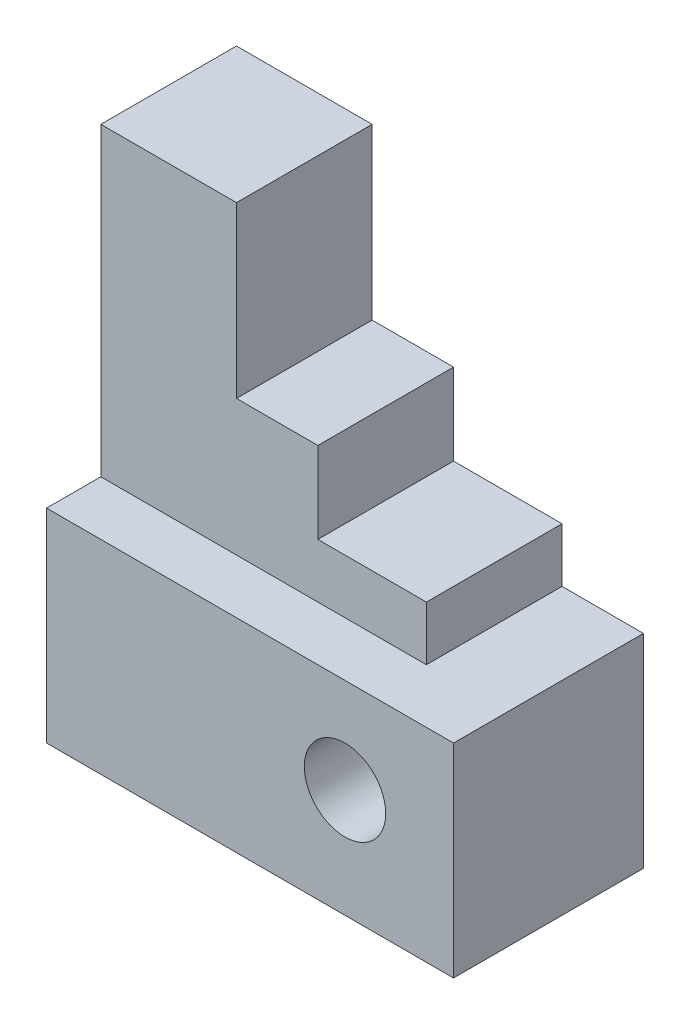
from build123d import *

# Parameters (mm, degrees)
SKETCH1_W               = 60
SKETCH1_H               = 28
BOSS_EXTRUDE1_DEPTH     = 75
CUT_EXTRUDE1_DEPTH      = 45
CUT_EXTRUDE2_DEPTH      = 99.107084352
CUT_EXTRUDE2_DEPTH_BACK = 99.107084352
SKETCH3_R               = 6


with BuildPart() as part:
    # Sketch1 → Boss-Extrude1 (new body)
    with BuildSketch(Plane(origin=(0, 0, 0), x_dir=(1, 0, 0), z_dir=(0, 1, 0))):
        with Locations((30, 14)):
            Rectangle(SKETCH1_W, SKETCH1_H)
    extrude(amount=BOSS_EXTRUDE1_DEPTH)

    # Sketch2 → Cut-Extrude1 (cut)
    with BuildSketch(Plane(origin=(0, 75, 0), x_dir=(1, 0, 0), z_dir=(0, 1, 0))):
        Polygon((60, 28), (48, 28), (48, 8), (0, 8), (0, 0), (48, 0), (60, 0), align=None)
    extrude(amount=-CUT_EXTRUDE1_DEPTH, mode=Mode.SUBTRACT)

    # Sketch3 → Cut-Extrude2 (cut, two sides: drawn at the far end of the back side and taken through both)
    with BuildSketch(Plane.XY.offset(-8).offset(-CUT_EXTRUDE2_DEPTH_BACK)):
        Polygon((32, 50), (32, 38), (48, 38), (48, 75), (20, 75), (20, 50), align=None)
        with Locations((44, 16)):
            Circle(SKETCH3_R)
    extrude(amount=CUT_EXTRUDE2_DEPTH + CUT_EXTRUDE2_DEPTH_BACK, mode=Mode.SUBTRACT)


solid = part.part
